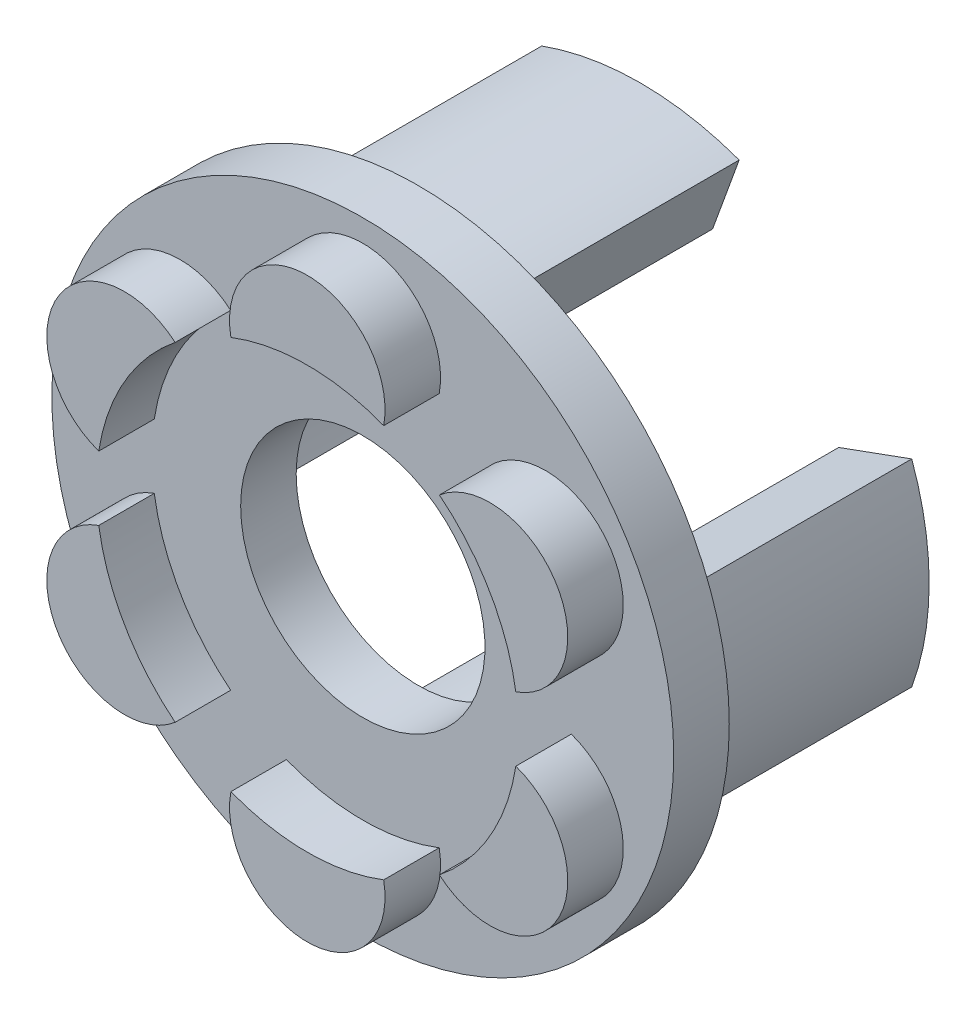
from build123d import *

# Parameters (mm, degrees)
SKETCH_1_R          = 28
EXTRUDE_1_DEPTH     = 5
EXTRUDE_2_DEPTH     = 20
SKETCH_3_R          = 11
CUT_EXTRUDE_1_DEPTH = 5
EXTRUDE_START       = 5
EXTRUDE_4_DEPTH     = 5


with BuildPart() as part:
    # 草图1 → 凸台-拉伸1 (new body)
    with BuildSketch(Plane.XY):
        Circle(SKETCH_1_R)
    extrude(amount=EXTRUDE_1_DEPTH)

    # 草图2 → 凸台-拉伸2 (add)
    with BuildSketch(Plane(origin=(0, 0, 0), x_dir=(-1, 0, 0), z_dir=(0, 0, -1))):
        with BuildLine():
            Line((-6.498382723, 17.854159795), (-8.892523726, 24.43200814))
            ThreePointArc((-8.892523726, 24.43200814), (0, 26), (8.892523726, 24.43200814))
            Line((8.892523726, 24.43200814), (6.498382723, 17.854159795))
            ThreePointArc((6.498382723, 17.854159795), (0, 19), (-6.498382723, 17.854159795))
        make_face()
        with BuildLine():
            Line((17.854159795, 6.498382723), (24.43200814, 8.892523726))
            ThreePointArc((24.43200814, 8.892523726), (26, 0), (24.43200814, -8.892523726))
            Line((24.43200814, -8.892523726), (17.854159795, -6.498382723))
            ThreePointArc((17.854159795, -6.498382723), (19, 0), (17.854159795, 6.498382723))
        make_face()
        with BuildLine():
            Line((6.498382723, -17.854159795), (8.892523726, -24.43200814))
            ThreePointArc((8.892523726, -24.43200814), (0, -26), (-8.892523726, -24.43200814))
            Line((-8.892523726, -24.43200814), (-6.498382723, -17.854159795))
            ThreePointArc((-6.498382723, -17.854159795), (0, -19), (6.498382723, -17.854159795))
        make_face()
        with BuildLine():
            Line((-17.854159795, -6.498382723), (-24.43200814, -8.892523726))
            ThreePointArc((-24.43200814, -8.892523726), (-26, 0), (-24.43200814, 8.892523726))
            Line((-24.43200814, 8.892523726), (-17.854159795, 6.498382723))
            ThreePointArc((-17.854159795, 6.498382723), (-19, 0), (-17.854159795, -6.498382723))
        make_face()
    extrude(amount=EXTRUDE_2_DEPTH)

    # 草图3 → 切除-拉伸1 (cut)
    with BuildSketch(Plane(origin=(0, 0, 0), x_dir=(-1, 0, 0), z_dir=(0, 0, -1))):
        Circle(SKETCH_3_R)
    extrude(amount=-CUT_EXTRUDE_1_DEPTH, mode=Mode.SUBTRACT)

    # 草图4 → 凸台-拉伸4 (add)
    with BuildSketch(Plane.XY.offset(5).offset(EXTRUDE_START)):
        with BuildLine():
            ThreePointArc((6.880207673, 17.710526316), (0, 26), (-6.880207673, 17.710526316))
            ThreePointArc((-6.880207673, 17.710526316), (0, 19), (6.880207673, 17.710526316))
        make_face()
        with BuildLine():
            ThreePointArc((18.77786954, 2.89682853), (22.516660498, 13), (11.897661868, 14.813697786))
            ThreePointArc((11.897661868, 14.813697786), (16.454482672, 9.5), (18.77786954, 2.89682853))
        make_face()
        with BuildLine():
            ThreePointArc((11.897661868, -14.813697786), (22.516660498, -13), (18.77786954, -2.89682853))
            ThreePointArc((18.77786954, -2.89682853), (16.454482672, -9.5), (11.897661868, -14.813697786))
        make_face()
        with BuildLine():
            ThreePointArc((-6.880207673, -17.710526316), (0, -26), (6.880207673, -17.710526316))
            ThreePointArc((6.880207673, -17.710526316), (0, -19), (-6.880207673, -17.710526316))
        make_face()
        with BuildLine():
            ThreePointArc((-18.77786954, -2.89682853), (-22.516660498, -13), (-11.897661868, -14.813697786))
            ThreePointArc((-11.897661868, -14.813697786), (-16.454482672, -9.5), (-18.77786954, -2.89682853))
        make_face()
        with BuildLine():
            ThreePointArc((-11.897661868, 14.813697786), (-22.516660498, 13), (-18.77786954, 2.89682853))
            ThreePointArc((-18.77786954, 2.89682853), (-16.454482672, 9.5), (-11.897661868, 14.813697786))
        make_face()
    extrude(amount=-EXTRUDE_4_DEPTH)


solid = part.part
